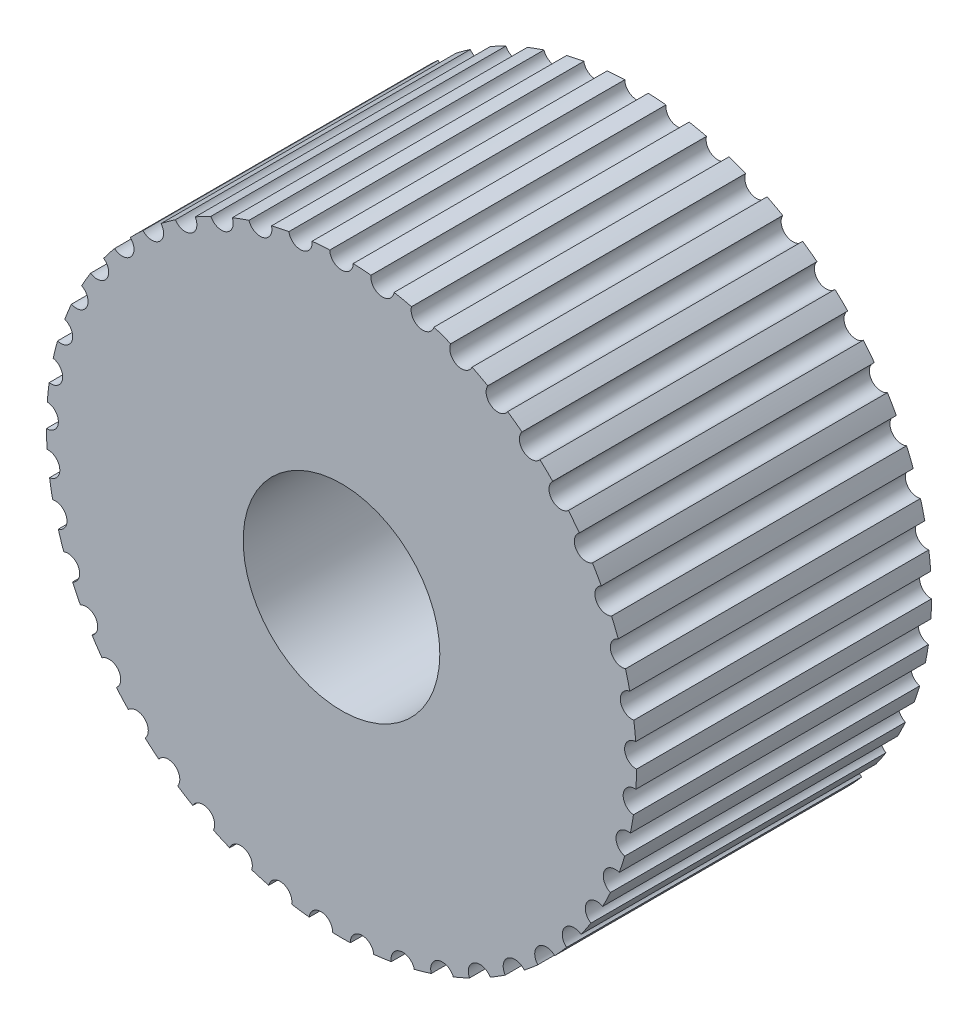
from build123d import *

# Parameters (mm, degrees)
SKETCH1_R           = 15
BOSS_EXTRUDE1_DEPTH = 15
SKETCH2_R           = 5
CUT_EXTRUDE1_DEPTH  = 15
SKETCH3_R           = 0.595755822
CUT_EXTRUDE2_DEPTH  = 15


with BuildPart() as part:
    # Sketch1 → Boss-Extrude1 (new body)
    with BuildSketch(Plane.XY):
        Circle(SKETCH1_R)
    extrude(amount=BOSS_EXTRUDE1_DEPTH)

    # Sketch2 → Cut-Extrude1 (cut)
    with BuildSketch(Plane.XY.offset(15)):
        Circle(SKETCH2_R)
    extrude(amount=-CUT_EXTRUDE1_DEPTH, mode=Mode.SUBTRACT)

    # Sketch3 → Cut-Extrude2 (cut)
    with BuildSketch(Plane.XY.offset(15)):
        with Locations((0, 15)):
            Circle(SKETCH3_R)
        with Locations((2.087596514, 14.854021031)):
            Circle(SKETCH3_R)
        with Locations((4.134560337, 14.418925439)):
            Circle(SKETCH3_R)
        with Locations((6.101049646, 13.703181865)):
            Circle(SKETCH3_R)
        with Locations((7.948788963, 12.720721442)):
            Circle(SKETCH3_R)
        with Locations((9.641814145, 11.490666647)):
            Circle(SKETCH3_R)
        with Locations((11.147172382, 10.036959095)):
            Circle(SKETCH3_R)
        with Locations((12.435563588, 8.387893552)):
            Circle(SKETCH3_R)
        with Locations((13.481910694, 6.575567202)):
            Circle(SKETCH3_R)
        with Locations((14.265847744, 4.635254916)):
            Circle(SKETCH3_R)
        with Locations((14.772116295, 2.604722665)):
            Circle(SKETCH3_R)
        with Locations((14.990862405, 0.523492451)):
            Circle(SKETCH3_R)
        with Locations((14.917828431, -1.567926949)):
            Circle(SKETCH3_R)
        with Locations((14.554435894, -3.628828434)):
            Circle(SKETCH3_R)
        with Locations((13.907757819, -5.619098901)):
            Circle(SKETCH3_R)
        with Locations((12.990381057, -7.5)):
            Circle(SKETCH3_R)
        with Locations((11.820161304, -9.23492213)):
            Circle(SKETCH3_R)
        with Locations((10.419875557, -10.790097005)):
            Circle(SKETCH3_R)
        with Locations((8.816778784, -12.135254916)):
            Circle(SKETCH3_R)
        with Locations((7.042073442, -13.244213893)):
            Circle(SKETCH3_R)
        with Locations((5.13030215, -14.095389312)):
            Circle(SKETCH3_R)
        with Locations((3.118675362, -14.672214011)):
            Circle(SKETCH3_R)
        with Locations((1.046347106, -14.963460754)):
            Circle(SKETCH3_R)
        with Locations((-1.046347106, -14.963460754)):
            Circle(SKETCH3_R)
        with Locations((-3.118675362, -14.672214011)):
            Circle(SKETCH3_R)
        with Locations((-5.13030215, -14.095389312)):
            Circle(SKETCH3_R)
        with Locations((-7.042073442, -13.244213893)):
            Circle(SKETCH3_R)
        with Locations((-8.816778784, -12.135254916)):
            Circle(SKETCH3_R)
        with Locations((-10.419875557, -10.790097005)):
            Circle(SKETCH3_R)
        with Locations((-11.820161304, -9.23492213)):
            Circle(SKETCH3_R)
        with Locations((-12.990381057, -7.5)):
            Circle(SKETCH3_R)
        with Locations((-13.907757818, -5.619098901)):
            Circle(SKETCH3_R)
        with Locations((-14.554435894, -3.628828434)):
            Circle(SKETCH3_R)
        with Locations((-14.917828431, -1.567926949)):
            Circle(SKETCH3_R)
        with Locations((-14.990862405, 0.523492451)):
            Circle(SKETCH3_R)
        with Locations((-14.772116295, 2.604722665)):
            Circle(SKETCH3_R)
        with Locations((-14.265847744, 4.635254916)):
            Circle(SKETCH3_R)
        with Locations((-13.481910694, 6.575567202)):
            Circle(SKETCH3_R)
        with Locations((-12.435563588, 8.387893552)):
            Circle(SKETCH3_R)
        with Locations((-11.147172382, 10.036959095)):
            Circle(SKETCH3_R)
        with Locations((-9.641814145, 11.490666647)):
            Circle(SKETCH3_R)
        with Locations((-7.948788963, 12.720721442)):
            Circle(SKETCH3_R)
        with Locations((-6.101049646, 13.703181865)):
            Circle(SKETCH3_R)
        with Locations((-4.134560337, 14.418925439)):
            Circle(SKETCH3_R)
        with Locations((-2.087596514, 14.854021031)):
            Circle(SKETCH3_R)
    extrude(amount=-CUT_EXTRUDE2_DEPTH, mode=Mode.SUBTRACT)


solid = part.part
